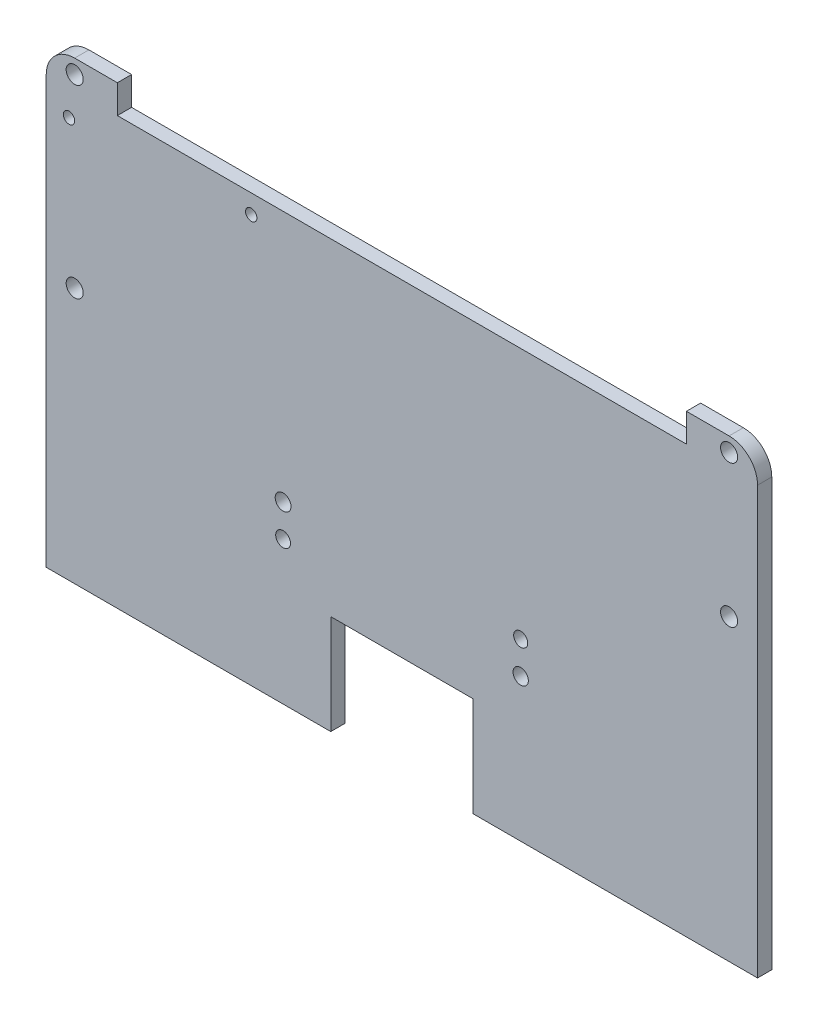
from build123d import *

# Parameters (mm, degrees)
BOSS_EXTRU_1_DEPTH      = 5
ESQUISSE2_R             = 3
ENL_V_MAT_EXTRU_1_DEPTH = 5
ESQUISSE3_W             = 200
ESQUISSE3_H             = 10
ENL_V_MAT_EXTRU_2_DEPTH = 10
ESQUISSE4_R             = 2
ENL_V_MAT_EXTRU_3_DEPTH = 297.858552176
ESQUISSE5_W             = 50
ESQUISSE5_H             = 35
ENL_V_MAT_EXTRU_4_DEPTH = 297.858552176
ESQUISSE6_R             = 2.6
ESQUISSE6_R_2           = 2.779338986
ESQUISSE6_R_3           = 2.697585155
ESQUISSE6_R_4           = 2.469314184
ENL_V_MAT_EXTRU_5_DEPTH = 297.858552176


with BuildPart() as part:
    # Esquisse1 → Boss.-Extru.1 (new body)
    with BuildSketch(Plane.XY):
        with BuildLine():
            Line((10, 0), (240, 0))
            ThreePointArc((240, 0), (247.071067812, -2.928932188), (250, -10))
            Line((250, -10), (250, -160))
            Line((250, -160), (0, -160))
            Line((0, -160), (0, -10))
            ThreePointArc((0, -10), (2.928932188, -2.928932188), (10, 0))
        make_face()
    extrude(amount=BOSS_EXTRU_1_DEPTH)

    # Esquisse2 → Enlèv. mat.-Extru.1 (cut)
    with BuildSketch(Plane.XY.offset(5)):
        with Locations((10, -5)):
            Circle(ESQUISSE2_R)
        with Locations(Location((240, -55, 0), (0, 0, 180))):
            Circle(ESQUISSE2_R)
        with Locations(Location((240, -5, 0), (0, 0, 180))):
            Circle(ESQUISSE2_R)
        with Locations((10, -70)):
            Circle(ESQUISSE2_R)
    extrude(amount=-ENL_V_MAT_EXTRU_1_DEPTH, mode=Mode.SUBTRACT)

    # Esquisse3 → Enlèv. mat.-Extru.2 (cut)
    with BuildSketch(Plane(origin=(0, 0, 0), x_dir=(-1, 0, 0), z_dir=(0, 0, -1))):
        with Locations((-125, -5)):
            Rectangle(ESQUISSE3_W, ESQUISSE3_H)
    extrude(amount=-ENL_V_MAT_EXTRU_2_DEPTH, mode=Mode.SUBTRACT)

    # Esquisse4 → Enlèv. mat.-Extru.3 (cut, through all)
    with BuildSketch(Plane(origin=(0, 0, 0), x_dir=(-1, 0, 0), z_dir=(0, 0, -1))):
        with Locations((-8.002599179, -19.132336536)):
            Circle(ESQUISSE4_R)
        with Locations((-72.047815248, -16.649941006)):
            Circle(ESQUISSE4_R)
    extrude(amount=-ENL_V_MAT_EXTRU_3_DEPTH, mode=Mode.SUBTRACT)

    # Esquisse5 → Enlèv. mat.-Extru.4 (cut, through all)
    with BuildSketch(Plane(origin=(0, 0, 0), x_dir=(-1, 0, 0), z_dir=(0, 0, -1))):
        with Locations((-125, -142.5)):
            Rectangle(ESQUISSE5_W, ESQUISSE5_H)
    extrude(amount=-ENL_V_MAT_EXTRU_4_DEPTH, mode=Mode.SUBTRACT)

    # Esquisse6 → Enlèv. mat.-Extru.5 (cut, through all)
    with BuildSketch(Plane.XY.offset(5)):
        with Locations((83.25, -109.8)):
            Circle(ESQUISSE6_R)
        with Locations((83.25, -98.5)):
            Circle(ESQUISSE6_R_2)
        with Locations((166.75, -109.8)):
            Circle(ESQUISSE6_R_3)
        with Locations((166.75, -98.5)):
            Circle(ESQUISSE6_R_4)
    extrude(amount=-ENL_V_MAT_EXTRU_5_DEPTH, mode=Mode.SUBTRACT)


solid = part.part
